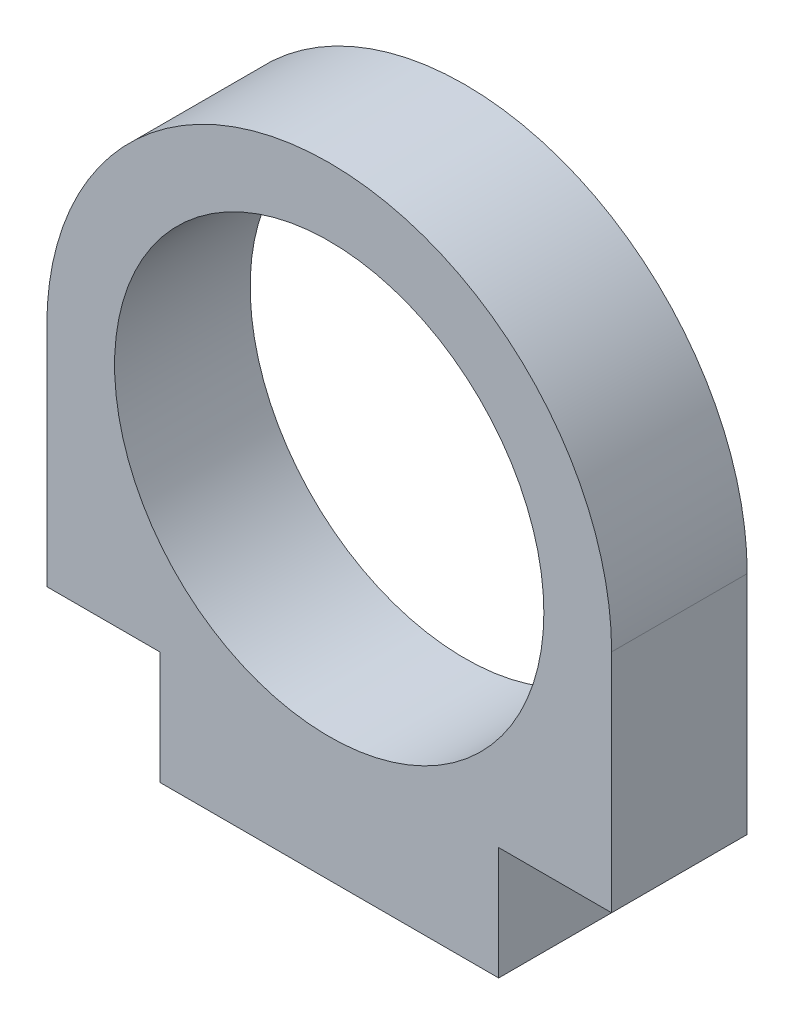
from build123d import *

# Parameters (mm, degrees)
CROQUIS1_R              = 9.5
CROQUIS1_W              = 15
CROQUIS1_H              = 5
SALIENTE_EXTRUIR1_DEPTH = 6


with BuildPart() as part:
    # Croquis1 → Saliente-Extruir1 (new body)
    # profile 1 of 2: a face of its own
    with BuildSketch(Plane.XY):
        with BuildLine():
            Line((-12.5, 0), (-12.5, -10))
            Line((-12.5, -10), (-7.5, -10))
            Line((-7.5, -10), (7.5, -10))
            Line((7.5, -10), (12.5, -10))
            Line((12.5, -10), (12.5, 0))
            ThreePointArc((12.5, 0), (0, 12.5), (-12.5, 0))
        make_face()
        Circle(CROQUIS1_R, mode=Mode.SUBTRACT)
    # profile 2 of 2: a face of its own
    with BuildSketch(Plane.XY):
        with Locations((0, -12.5)):
            Rectangle(CROQUIS1_W, CROQUIS1_H)
    extrude(amount=SALIENTE_EXTRUIR1_DEPTH)


solid = part.part
